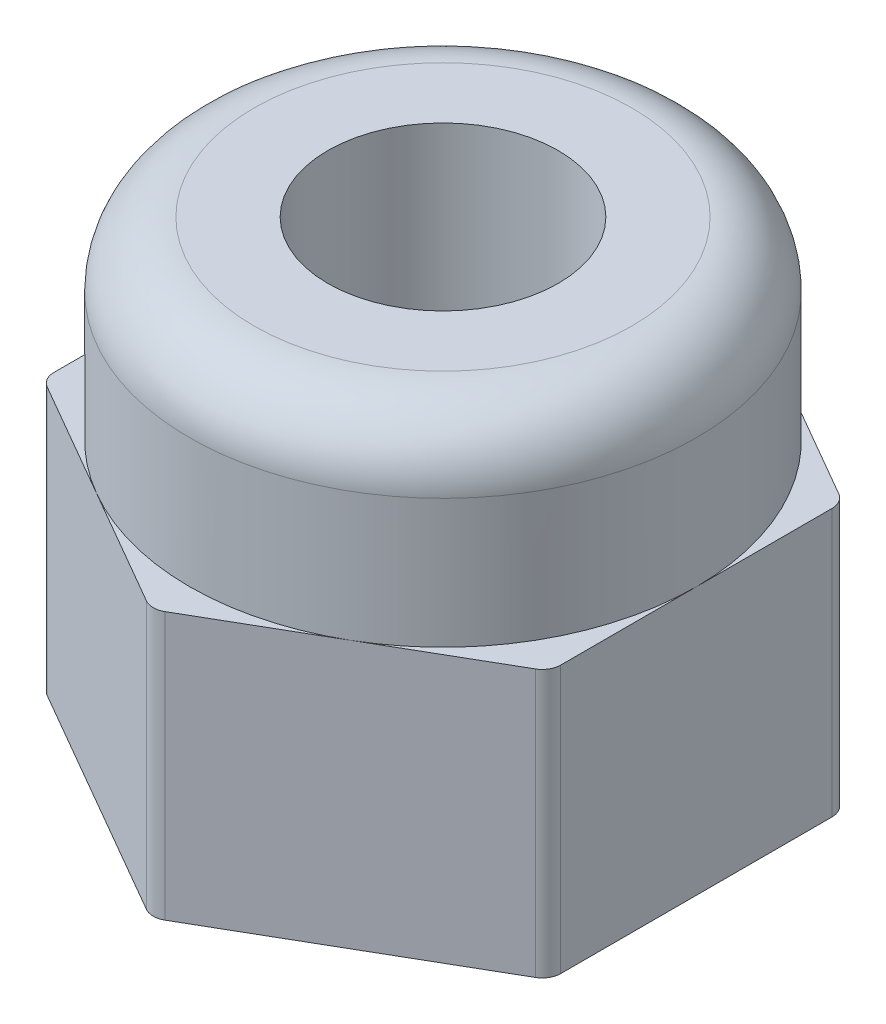
from build123d import *

# Parameters (mm, degrees)
EXTRUDE_1_DEPTH        = 2.9
SKETCH_2_R             = 2.75
EXTRUDE_2_DEPTH        = 5
FILLET_2_R             = 0.7
HOLE_WIZARD_M3_1_D     = 2.5
HOLE_WIZARD_M3_1_DEPTH = 10.1
HOLE_WIZARD_M3_1_TIP   = 0.751075774
FILLET_4_R             = 0.2


with BuildPart() as part:
    # 草图1 → 凸台-拉伸1 (new body)
    with BuildSketch(Plane(origin=(0, 0, 0), x_dir=(1, 0, 0), z_dir=(0, 1, 0))):
        Polygon((2.75, -1.58771324), (2.75, 1.58771324), (0, 3.175426481), (-2.75, 1.58771324), (-2.75, -1.58771324), (0, -3.175426481), align=None)
    extrude(amount=EXTRUDE_1_DEPTH)

    # 草图2 → 凸台-拉伸2 (add)
    with BuildSketch(Plane(origin=(0, 0, 0), x_dir=(-1, 0, 0), z_dir=(0, -1, 0))):
        with Locations(Location((0, 0, 0), (0, 0, 90))):
            Circle(SKETCH_2_R)
    extrude(amount=-EXTRUDE_2_DEPTH)

    # 圆角2
    fillet_2_edges = [part.edges().sort_by_distance(p)[0] for p in [
        (0, 5, 2.75),
    ]]
    fillet(fillet_2_edges, radius=FILLET_2_R)

    # M3 螺纹孔1
    with Locations(Plane(origin=(0, 0, 0), x_dir=(-1, 0, 0), z_dir=(0, -1, 0))):
        with Locations((0, 0)):
            Hole(HOLE_WIZARD_M3_1_D / 2, depth=HOLE_WIZARD_M3_1_DEPTH)
            with Locations((0, 0, -(HOLE_WIZARD_M3_1_DEPTH + HOLE_WIZARD_M3_1_TIP / 2))):  # 118° drill point
                Cone(0, HOLE_WIZARD_M3_1_D / 2, HOLE_WIZARD_M3_1_TIP, mode=Mode.SUBTRACT)

    # 圆角4
    fillet_4_edges = [part.edges().sort_by_distance(p)[0] for p in [
        (0, 1.45, 3.175426481),
        (-2.75, 1.45, 1.58771324),
        (-2.75, 1.45, -1.58771324),
        (0, 1.45, -3.175426481),
        (2.75, 1.45, -1.58771324),
        (2.75, 1.45, 1.58771324),
    ]]
    fillet(fillet_4_edges, radius=FILLET_4_R)


solid = part.part
